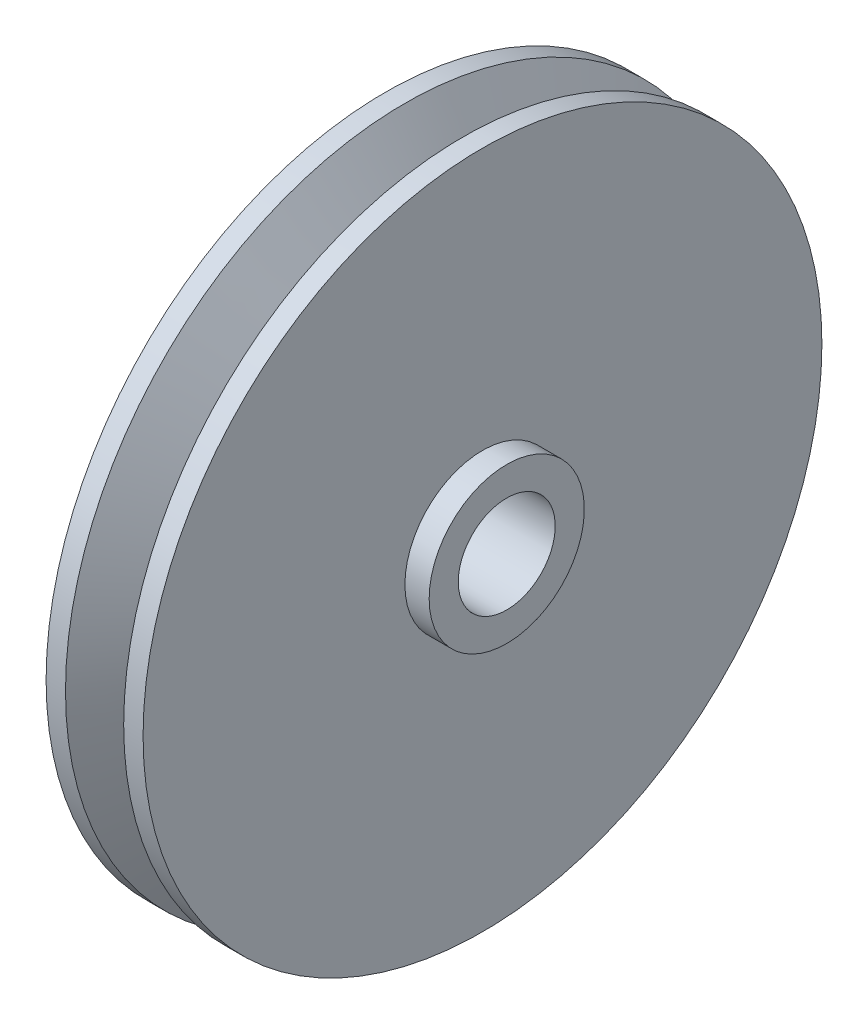
from build123d import *


with BuildPart() as part:
    # Sketch1 → Revolve1 (revolve)
    with BuildSketch(Plane.XY, mode=Mode.PRIVATE) as revolve1_sk:
        Polygon((0, 6.35), (0, 44.45), (2.54, 44.45), (6.35, 38.1), (10.16, 44.45), (12.7, 44.45), (12.7, 10.16), (15.875, 10.16), (15.875, 6.35), align=None)
    revolve(revolve1_sk.sketch.rotate(Axis((0, 0, 0), (1, 0, 0)), 90), axis=Axis((0, 0, 0), (1, 0, 0)))


solid = part.part
